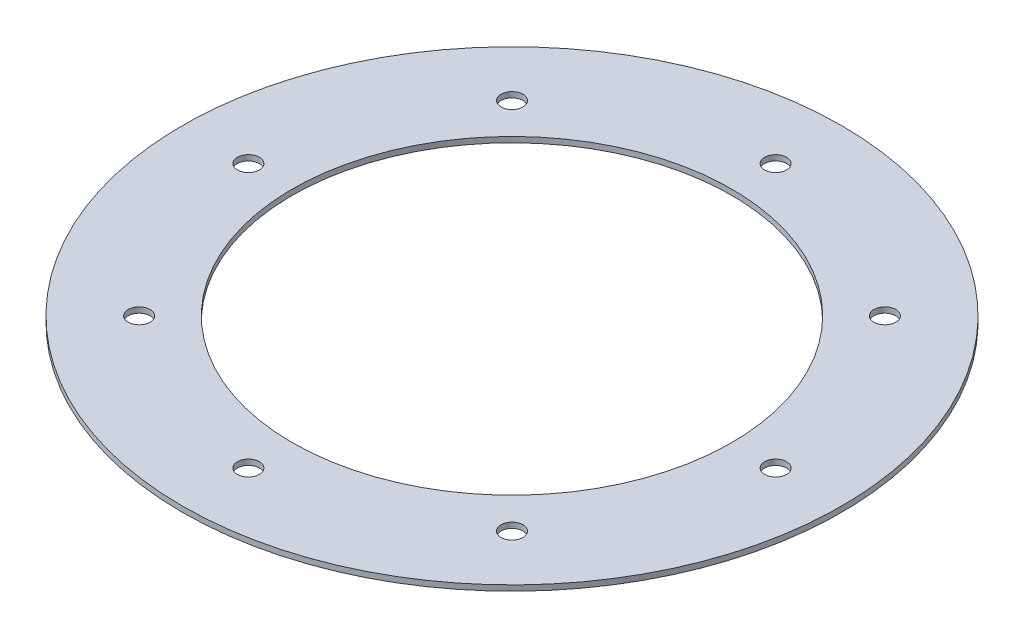
from build123d import *

# Parameters (mm, degrees)
SKETCH1_R           = 60
SKETCH1_R_2         = 2
SKETCH1_R_3         = 40
BOSS_EXTRUDE1_DEPTH = 1


with BuildPart() as part:
    # Sketch1 → Boss-Extrude1 (new body)
    with BuildSketch(Plane(origin=(0, 0, 0), x_dir=(1, 0, 0), z_dir=(0, 1, 0))):
        with Locations(Location((0, 0, 0), (0, 0, 270))):
            Circle(SKETCH1_R)
        with Locations(Location((0, 48, 0), (0, 0, 270))):
            Circle(SKETCH1_R_2, mode=Mode.SUBTRACT)
        with Locations(Location((33.941125497, 33.941125497, 0), (0, 0, 270))):
            Circle(SKETCH1_R_2, mode=Mode.SUBTRACT)
        with Locations(Location((48, 0, 0), (0, 0, 270))):
            Circle(SKETCH1_R_2, mode=Mode.SUBTRACT)
        with Locations(Location((33.941125497, -33.941125497, 0), (0, 0, 270))):
            Circle(SKETCH1_R_2, mode=Mode.SUBTRACT)
        with Locations(Location((0, -48, 0), (0, 0, 270))):
            Circle(SKETCH1_R_2, mode=Mode.SUBTRACT)
        with Locations(Location((-33.941125497, -33.941125497, 0), (0, 0, 270))):
            Circle(SKETCH1_R_2, mode=Mode.SUBTRACT)
        with Locations(Location((-48, 0, 0), (0, 0, 270))):
            Circle(SKETCH1_R_2, mode=Mode.SUBTRACT)
        with Locations(Location((-33.941125497, 33.941125497, 0), (0, 0, 270))):
            Circle(SKETCH1_R_2, mode=Mode.SUBTRACT)
        with Locations(Location((0, 0, 0), (0, 0, 270))):
            Circle(SKETCH1_R_3, mode=Mode.SUBTRACT)
    extrude(amount=BOSS_EXTRUDE1_DEPTH)


solid = part.part
